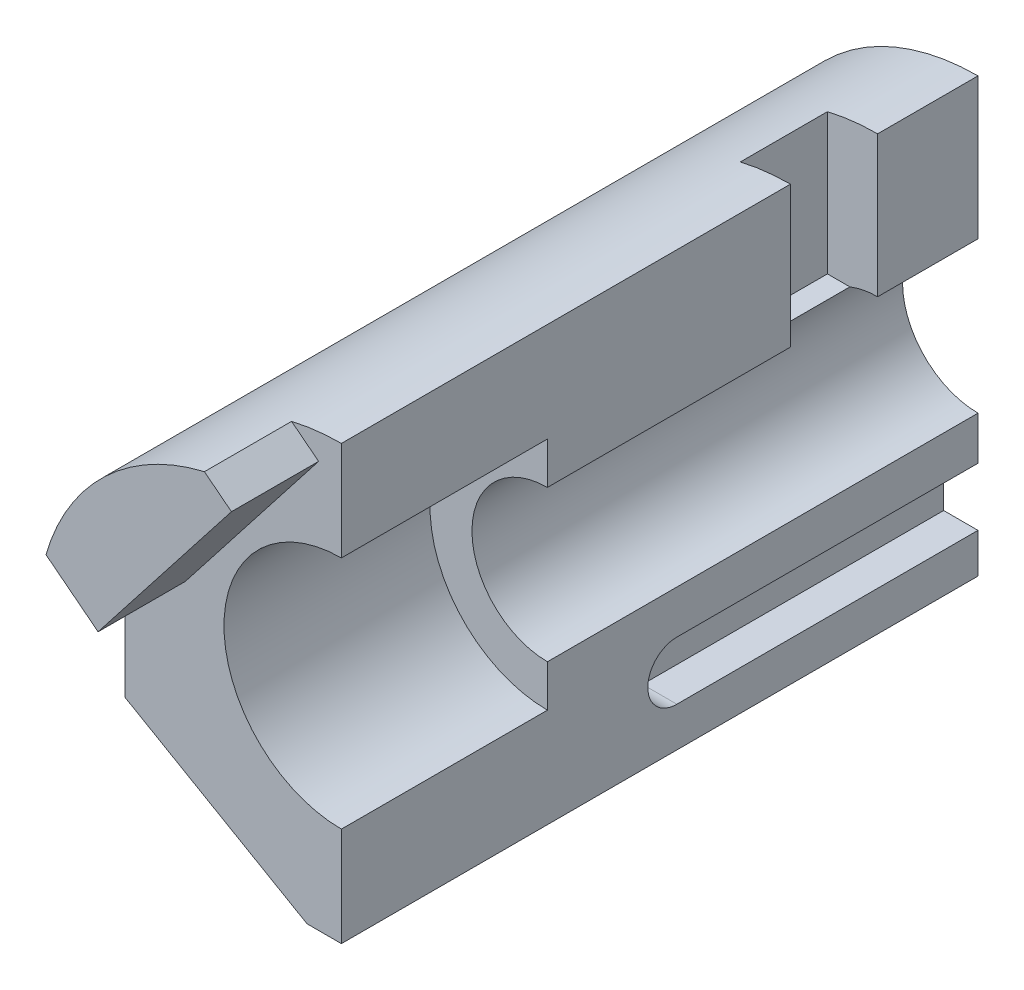
from build123d import *

# Parameters (mm, degrees)
BOSS_EXTRUDE1_DEPTH = 241
CUT_EXTRUDE1_DEPTH  = 78
BOSS_EXTRUDE2_START = 33
BOSS_EXTRUDE2_DEPTH = 33
SKETCH5_W           = 33
SKETCH5_H           = 53.425
CUT_EXTRUDE2_DEPTH  = 19
SKETCH7_W           = 19
SKETCH7_H           = 33
CUT_EXTRUDE3_DEPTH  = 2
CUT_EXTRUDE4_DEPTH  = 13


with BuildPart() as part:
    # Sketch2 → Boss-Extrude1 (new body)
    with BuildSketch(Plane.XY):
        with BuildLine():
            Line((0, -28.575), (0, -82))
            Line((0, -82), (-13, -82))
            Line((-13, -82), (-82, -42.162831426))
            Line((-82, -42.162831426), (-82, 0))
            ThreePointArc((-82, 0), (-57.982756057, 57.982756057), (0, 82))
            Line((0, 82), (0, 28.575))
            ThreePointArc((0, 28.575), (-28.575, 0), (0, -28.575))
        make_face()
    extrude(amount=-BOSS_EXTRUDE1_DEPTH)

    # Sketch3 → Cut-Extrude1 (cut)
    with BuildSketch(Plane.XY):
        with BuildLine():
            Line((0, 44.45), (0, 28.575))
            ThreePointArc((0, 28.575), (-28.575, 0), (0, -28.575))
            Line((0, -28.575), (0, -44.45))
            ThreePointArc((0, -44.45), (-44.45, 0), (0, 44.45))
        make_face()
    extrude(amount=-CUT_EXTRUDE1_DEPTH, mode=Mode.SUBTRACT)

    # Sketch4 → Boss-Extrude2 (add)
    with BuildSketch(Plane.XY.offset(BOSS_EXTRUDE2_START)):
        with BuildLine():
            Line((-18.851828073, 79.803562441), (-8.61759969, 71.807706907))
            Line((-8.61759969, 71.807706907), (-59.101840666, 7.190825111))
            Line((-59.101840666, 7.190825111), (-78.824213609, 22.599631612))
            ThreePointArc((-78.824213609, 22.599631612), (-56.597037955, 59.336121332), (-18.851828073, 79.803562441))
        make_face()
    extrude(amount=-BOSS_EXTRUDE2_DEPTH)

    # Sketch5 → Cut-Extrude2 (cut)
    with BuildSketch(Plane(origin=(0, 0, 0), x_dir=(0, 0, -1), z_dir=(1, 0, 0))):
        with Locations((186.5, 55.2875)):
            Rectangle(SKETCH5_W, SKETCH5_H)
    extrude(amount=-CUT_EXTRUDE2_DEPTH, mode=Mode.SUBTRACT)

    # Sketch7 → Cut-Extrude3 (cut)
    with BuildSketch(Plane(origin=(0, 28.575, 0), x_dir=(1, 0, 0), z_dir=(0, 1, 0))):
        with Locations((-9.5, 186.5)):
            Rectangle(SKETCH7_W, SKETCH7_H)
    extrude(amount=-CUT_EXTRUDE3_DEPTH, mode=Mode.SUBTRACT)

    # Sketch8 → Cut-Extrude4 (cut)
    with BuildSketch(Plane(origin=(0, 0, 0), x_dir=(0, 0, -1), z_dir=(1, 0, 0))):
        with BuildLine():
            Line((241, -45), (127, -45))
            ThreePointArc((127, -45), (116, -56), (127, -67))
            Line((127, -67), (241, -67))
            Line((241, -67), (241, -45))
        make_face()
    extrude(amount=-CUT_EXTRUDE4_DEPTH, mode=Mode.SUBTRACT)


solid = part.part
